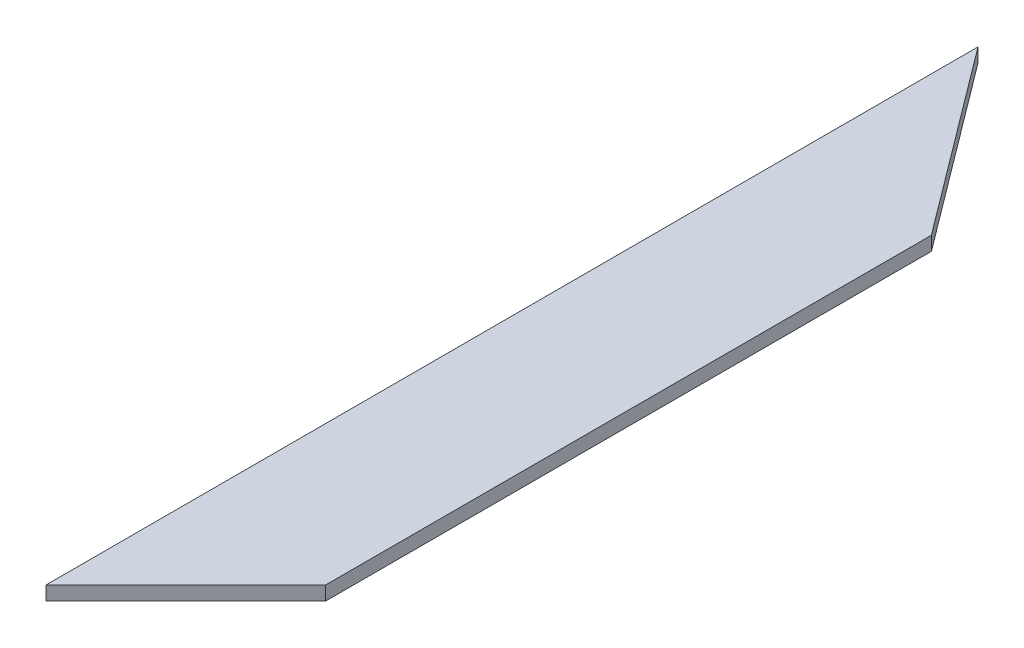
from build123d import *

# Parameters (mm, degrees)
EXTRUDE_1_DEPTH = 3


with BuildPart() as part:
    # Эскиз1 → Бобышка-Вытянуть1 (new body)
    with BuildSketch(Plane(origin=(0, 0, 0), x_dir=(1, 0, 0), z_dir=(0, 1, 0))):
        Polygon((0, 0), (0, 200), (30, 160), (30, 30), align=None)
    extrude(amount=EXTRUDE_1_DEPTH)


solid = part.part
